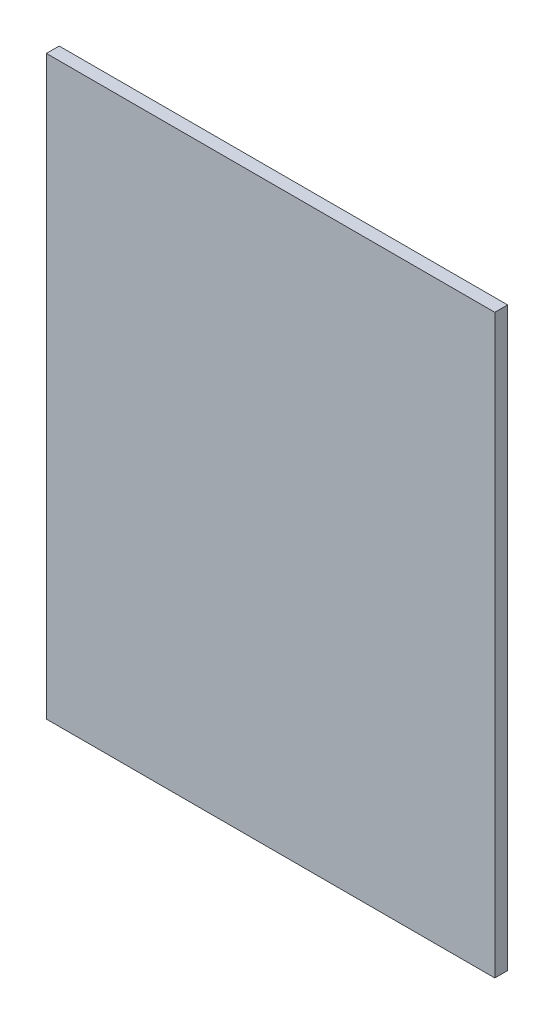
from build123d import *

# Parameters (mm, degrees)
SKETCH1_W           = 140
SKETCH1_H           = 180
BOSS_EXTRUDE1_DEPTH = 4


with BuildPart() as part:
    # Sketch1 → Boss-Extrude1 (new body)
    with BuildSketch(Plane.XY):
        Rectangle(SKETCH1_W, SKETCH1_H)
    extrude(amount=BOSS_EXTRUDE1_DEPTH)


solid = part.part
